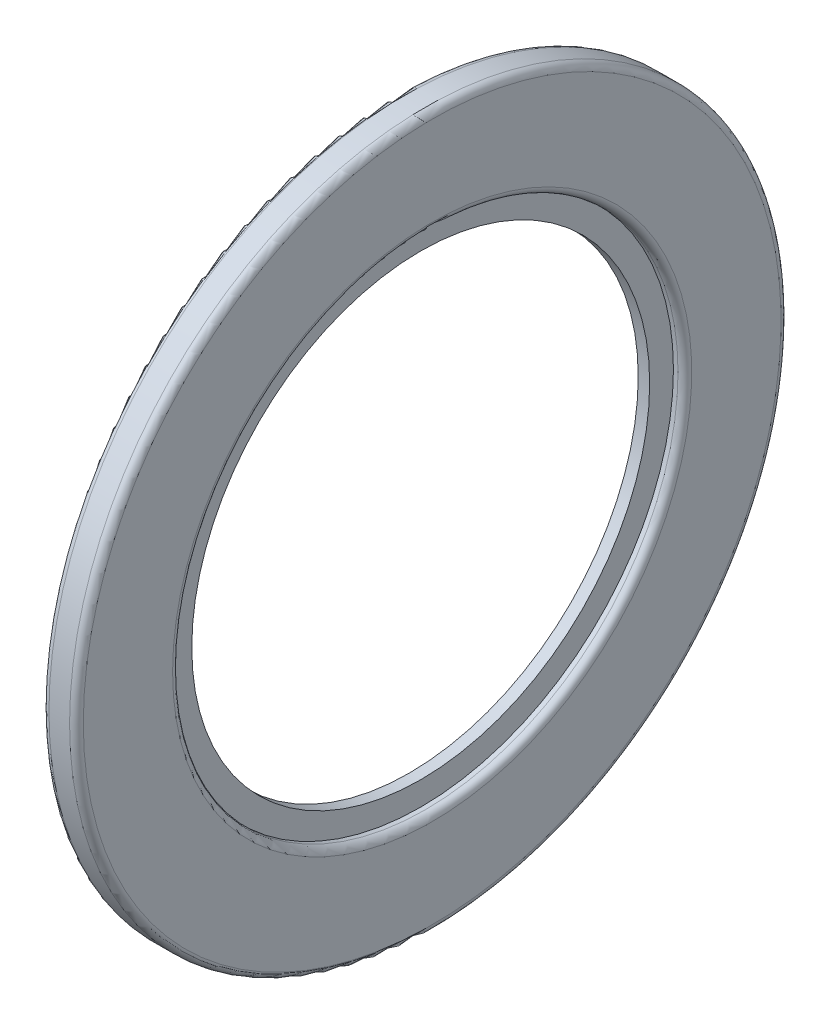
from build123d import *

# Parameters (mm, degrees)
CAGSPISKE_W = 1
CAGSPISKE_H = 10


with BuildPart() as part:
    # CagSpiSke → CageSpine (revolve)
    with BuildSketch(Plane.XY):
        with Locations((0, 25)):
            Rectangle(CAGSPISKE_W, CAGSPISKE_H)
    revolve(axis=Axis((-34.925, 0, 0), (1, 0, 0)))

    # RolSimSke → RollersSimplified (revolve)
    with BuildSketch(Plane.XY):
        with BuildLine():
            Line((-0.9, 31.075), (0.9, 31.075))
            ThreePointArc((0.9, 31.075), (1.324264069, 30.899264069), (1.5, 30.475))
            Line((1.5, 30.475), (1.5, 22.675))
            ThreePointArc((1.5, 22.675), (1.324264069, 22.250735931), (0.9, 22.075))
            Line((0.9, 22.075), (-0.9, 22.075))
            ThreePointArc((-0.9, 22.075), (-1.324264069, 22.250735931), (-1.5, 22.675))
            Line((-1.5, 22.675), (-1.5, 30.475))
            ThreePointArc((-1.5, 30.475), (-1.324264069, 30.899264069), (-0.9, 31.075))
        make_face()
    revolve(axis=Axis((-17.78, 0, 0), (1, 0, 0)))


solid = part.part
